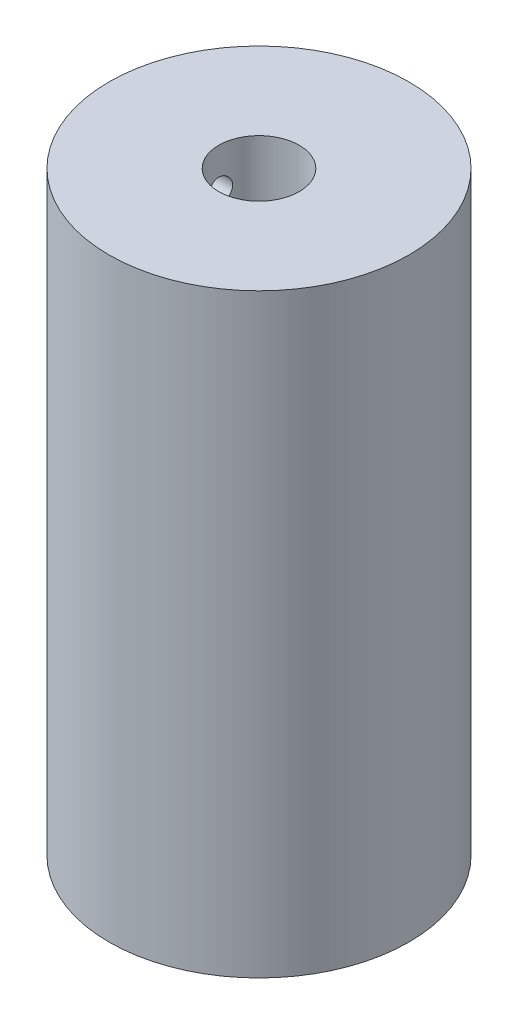
from build123d import *

# Parameters (mm, degrees)
SKETCH1_R                   = 18.643111828
F_40MM_ARM_DEPTH            = 41
SKETCH2_R                   = 5
F_10MM_HOLE_10MM_DEEP_DEPTH = 10
SKETCH3_R                   = 1.5
F_0_01M_SCREW_HOLE_DEPTH    = 25
BOSS_EXTRUDE1_START         = 33
SKETCH5_R                   = 18.643111828
BOSS_EXTRUDE1_DEPTH         = 33
SKETCH4_R                   = 5
CUT_EXTRUDE2_DEPTH          = 92


with BuildPart() as part:
    # Sketch1 → 40mm arm (new body)
    with BuildSketch(Plane(origin=(0, 0, 0), x_dir=(1, 0, 0), z_dir=(0, 1, 0))):
        with Locations(Location((0, 0, 0), (0, 0, 270))):
            Circle(SKETCH1_R)
    extrude(amount=F_40MM_ARM_DEPTH)

    # Sketch2 → 10mm hole, 10mm deep (cut)
    with BuildSketch(Plane(origin=(0, 41, 0), x_dir=(1, 0, 0), z_dir=(0, 1, 0))):
        with Locations(Location((0, 0, 0), (0, 0, 270))):
            Circle(SKETCH2_R)
    extrude(amount=-F_10MM_HOLE_10MM_DEEP_DEPTH, mode=Mode.SUBTRACT)

    # Sketch3 → 0.01m screw hole (cut)
    with BuildSketch(Plane(origin=(0, 0, 0), x_dir=(0, 0, -1), z_dir=(1, 0, 0))):
        with Locations((0, 36.059550575)):
            Circle(SKETCH3_R)
    extrude(amount=-F_0_01M_SCREW_HOLE_DEPTH, mode=Mode.SUBTRACT)

    # Sketch5 → Boss-Extrude1 (add)
    with BuildSketch(Plane.XZ.offset(BOSS_EXTRUDE1_START)):
        with Locations(Location((0, 0, 0), (0, 0, 270))):
            Circle(SKETCH5_R)
    extrude(amount=-BOSS_EXTRUDE1_DEPTH)

    # Sketch4 → Cut-Extrude2 (cut)
    with BuildSketch(Plane.XZ):
        with Locations(Location((0, 0, 0), (0, 0, 90))):
            Circle(SKETCH4_R)
    extrude(amount=CUT_EXTRUDE2_DEPTH, mode=Mode.SUBTRACT)


solid = part.part
